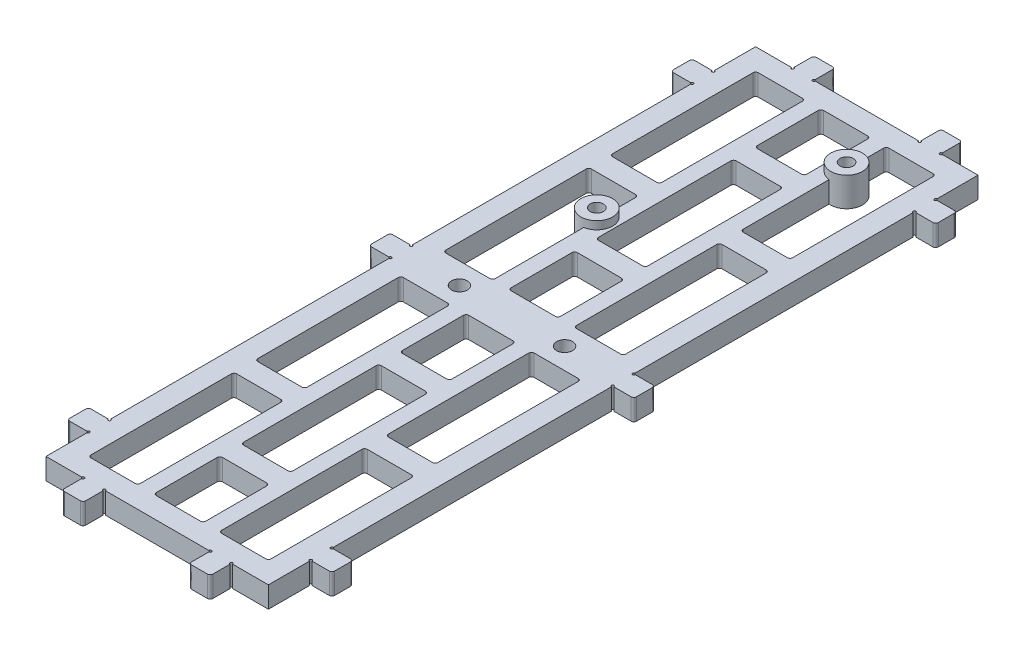
from build123d import *

# Parameters (mm, degrees)
SKETCH_1_W               = 42
SKETCH_1_H               = 134
SKETCH_1_R               = 1.5
EXTRUDE_1_DEPTH          = 2
CUT_EXTRUDE_4_DEPTH      = 4
EXTRUDE_3_DEPTH          = 1.5
EXTRUDE_3_DEPTH_BACK     = 4
SKETCH_2_R               = 3
CUT_EXTRUDE_5_DEPTH      = 71.32780389
CUT_EXTRUDE_5_DEPTH_BACK = 71.32780389
SKETCH_3_R               = 1.25
EXTRUDE_4_DEPTH          = 4
CUT_EXTRUDE_6_DEPTH      = 76.37904218
CUT_EXTRUDE_6_DEPTH_BACK = 76.37904218
SKETCH_6_R               = 0.25


with BuildPart() as part:
    # 草图1 → 凸台-拉伸1 (new, symmetric)
    with BuildSketch(Plane(origin=(0, 0, 0), x_dir=(1, 0, 0), z_dir=(0, 1, 0))):
        Rectangle(SKETCH_1_W, SKETCH_1_H)
        with Locations(Location((9.925, 0, 0), (0, 0, 270))):
            Circle(SKETCH_1_R, mode=Mode.SUBTRACT)
        with Locations(Location((-9.925, 0, 0), (0, 0, 90))):
            Circle(SKETCH_1_R, mode=Mode.SUBTRACT)
    extrude(amount=EXTRUDE_1_DEPTH, both=True)

    # 草图4 → 切除-拉伸4 (cut)
    with BuildSketch(Plane(origin=(0, 2, 0), x_dir=(1, 0, 0), z_dir=(0, 1, 0))):
        with BuildLine():
            Line((-16.5, -4), (-8.17, -4))
            ThreePointArc((-8.17, -4), (-7.816446609, -4.146446609), (-7.67, -4.5))
            Line((-7.67, -4.5), (-7.67, -31))
            ThreePointArc((-7.67, -31), (-7.816446609, -31.353553391), (-8.17, -31.5))
            Line((-8.17, -31.5), (-16.5, -31.5))
            ThreePointArc((-16.5, -31.5), (-16.853553391, -31.353553391), (-17, -31))
            Line((-17, -31), (-17, -4.5))
            ThreePointArc((-17, -4.5), (-16.853553391, -4.146446609), (-16.5, -4))
        make_face()
        with BuildLine():
            Line((16.5, -4), (8.17, -4))
            ThreePointArc((8.17, -4), (7.816446609, -4.146446609), (7.67, -4.5))
            Line((7.67, -4.5), (7.67, -31))
            ThreePointArc((7.67, -31), (7.816446609, -31.353553391), (8.17, -31.5))
            Line((8.17, -31.5), (16.5, -31.5))
            ThreePointArc((16.5, -31.5), (16.853553391, -31.353553391), (17, -31))
            Line((17, -31), (17, -4.5))
            ThreePointArc((17, -4.5), (16.853553391, -4.146446609), (16.5, -4))
        make_face()
        with BuildLine():
            Line((-16.5, -63), (-8.17, -63))
            ThreePointArc((-8.17, -63), (-7.816446609, -62.853553391), (-7.67, -62.5))
            Line((-7.67, -62.5), (-7.67, -36))
            ThreePointArc((-7.67, -36), (-7.816446609, -35.646446609), (-8.17, -35.5))
            Line((-8.17, -35.5), (-16.5, -35.5))
            ThreePointArc((-16.5, -35.5), (-16.853553391, -35.646446609), (-17, -36))
            Line((-17, -36), (-17, -62.5))
            ThreePointArc((-17, -62.5), (-16.853553391, -62.853553391), (-16.5, -63))
        make_face()
        with BuildLine():
            Line((16.5, -63), (8.17, -63))
            ThreePointArc((8.17, -63), (7.816446609, -62.853553391), (7.67, -62.5))
            Line((7.67, -62.5), (7.67, -36))
            ThreePointArc((7.67, -36), (7.816446609, -35.646446609), (8.17, -35.5))
            Line((8.17, -35.5), (16.5, -35.5))
            ThreePointArc((16.5, -35.5), (16.853553391, -35.646446609), (17, -36))
            Line((17, -36), (17, -62.5))
            ThreePointArc((17, -62.5), (16.853553391, -62.853553391), (16.5, -63))
        make_face()
        with BuildLine():
            Line((-4.67, -62.5), (-4.67, -51))
            ThreePointArc((-4.67, -51), (-4.523553391, -50.646446609), (-4.17, -50.5))
            Line((-4.17, -50.5), (4.17, -50.5))
            ThreePointArc((4.17, -50.5), (4.523553391, -50.646446609), (4.67, -51))
            Line((4.67, -51), (4.67, -62.5))
            ThreePointArc((4.67, -62.5), (4.523553391, -62.853553391), (4.17, -63))
            Line((4.17, -63), (-4.17, -63))
            ThreePointArc((-4.17, -63), (-4.523553391, -62.853553391), (-4.67, -62.5))
        make_face()
        with BuildLine():
            Line((-4.17, -20.5), (4.17, -20.5))
            ThreePointArc((4.17, -20.5), (4.523553391, -20.646446609), (4.67, -21))
            Line((4.67, -21), (4.67, -46))
            ThreePointArc((4.67, -46), (4.523553391, -46.353553391), (4.17, -46.5))
            Line((4.17, -46.5), (-4.17, -46.5))
            ThreePointArc((-4.17, -46.5), (-4.523553391, -46.353553391), (-4.67, -46))
            Line((-4.67, -46), (-4.67, -21))
            ThreePointArc((-4.67, -21), (-4.523553391, -20.646446609), (-4.17, -20.5))
        make_face()
        with BuildLine():
            Line((-4.17, -4), (4.17, -4))
            ThreePointArc((4.17, -4), (4.523553391, -4.146446609), (4.67, -4.5))
            Line((4.67, -4.5), (4.67, -16))
            ThreePointArc((4.67, -16), (4.523553391, -16.353553391), (4.17, -16.5))
            Line((4.17, -16.5), (-4.17, -16.5))
            ThreePointArc((-4.17, -16.5), (-4.523553391, -16.353553391), (-4.67, -16))
            Line((-4.67, -16), (-4.67, -4.5))
            ThreePointArc((-4.67, -4.5), (-4.523553391, -4.146446609), (-4.17, -4))
        make_face()
        with BuildLine():
            Line((-4.17, 63), (4.17, 63))
            ThreePointArc((4.17, 63), (4.523553391, 62.853553391), (4.67, 62.5))
            Line((4.67, 62.5), (4.67, 51))
            ThreePointArc((4.67, 51), (4.523553391, 50.646446609), (4.17, 50.5))
            Line((4.17, 50.5), (-4.17, 50.5))
            ThreePointArc((-4.17, 50.5), (-4.523553391, 50.646446609), (-4.67, 51))
            Line((-4.67, 51), (-4.67, 62.5))
            ThreePointArc((-4.67, 62.5), (-4.523553391, 62.853553391), (-4.17, 63))
        make_face()
        with BuildLine():
            Line((-17, 62.5), (-17, 36))
            ThreePointArc((-17, 36), (-16.853553391, 35.646446609), (-16.5, 35.5))
            Line((-16.5, 35.5), (-8.17, 35.5))
            ThreePointArc((-8.17, 35.5), (-7.816446609, 35.646446609), (-7.67, 36))
            Line((-7.67, 36), (-7.67, 62.5))
            ThreePointArc((-7.67, 62.5), (-7.816446609, 62.853553391), (-8.17, 63))
            Line((-8.17, 63), (-16.5, 63))
            ThreePointArc((-16.5, 63), (-16.853553391, 62.853553391), (-17, 62.5))
        make_face()
        with BuildLine():
            Line((-16.5, 31.5), (-8.17, 31.5))
            ThreePointArc((-8.17, 31.5), (-7.816446609, 31.353553391), (-7.67, 31))
            Line((-7.67, 31), (-7.67, 4.5))
            ThreePointArc((-7.67, 4.5), (-7.816446609, 4.146446609), (-8.17, 4))
            Line((-8.17, 4), (-16.5, 4))
            ThreePointArc((-16.5, 4), (-16.853553391, 4.146446609), (-17, 4.5))
            Line((-17, 4.5), (-17, 31))
            ThreePointArc((-17, 31), (-16.853553391, 31.353553391), (-16.5, 31.5))
        make_face()
        with BuildLine():
            Line((-4.17, 16.5), (4.17, 16.5))
            ThreePointArc((4.17, 16.5), (4.523553391, 16.353553391), (4.67, 16))
            Line((4.67, 16), (4.67, 4.5))
            ThreePointArc((4.67, 4.5), (4.523553391, 4.146446609), (4.17, 4))
            Line((4.17, 4), (-4.17, 4))
            ThreePointArc((-4.17, 4), (-4.523553391, 4.146446609), (-4.67, 4.5))
            Line((-4.67, 4.5), (-4.67, 16))
            ThreePointArc((-4.67, 16), (-4.523553391, 16.353553391), (-4.17, 16.5))
        make_face()
        with BuildLine():
            Line((-4.17, 46.5), (4.17, 46.5))
            ThreePointArc((4.17, 46.5), (4.523553391, 46.353553391), (4.67, 46))
            Line((4.67, 46), (4.67, 21))
            ThreePointArc((4.67, 21), (4.523553391, 20.646446609), (4.17, 20.5))
            Line((4.17, 20.5), (-4.17, 20.5))
            ThreePointArc((-4.17, 20.5), (-4.523553391, 20.646446609), (-4.67, 21))
            Line((-4.67, 21), (-4.67, 46))
            ThreePointArc((-4.67, 46), (-4.523553391, 46.353553391), (-4.17, 46.5))
        make_face()
        with BuildLine():
            Line((17, 4.5), (17, 31))
            ThreePointArc((17, 31), (16.853553391, 31.353553391), (16.5, 31.5))
            Line((16.5, 31.5), (8.17, 31.5))
            ThreePointArc((8.17, 31.5), (7.816446609, 31.353553391), (7.67, 31))
            Line((7.67, 31), (7.67, 4.5))
            ThreePointArc((7.67, 4.5), (7.816446609, 4.146446609), (8.17, 4))
            Line((8.17, 4), (16.5, 4))
            ThreePointArc((16.5, 4), (16.853553391, 4.146446609), (17, 4.5))
        make_face()
        with BuildLine():
            Line((17, 62.5), (17, 36))
            ThreePointArc((17, 36), (16.853553391, 35.646446609), (16.5, 35.5))
            Line((16.5, 35.5), (8.17, 35.5))
            ThreePointArc((8.17, 35.5), (7.816446609, 35.646446609), (7.67, 36))
            Line((7.67, 36), (7.67, 62.5))
            ThreePointArc((7.67, 62.5), (7.816446609, 62.853553391), (8.17, 63))
            Line((8.17, 63), (16.5, 63))
            ThreePointArc((16.5, 63), (16.853553391, 62.853553391), (17, 62.5))
        make_face()
    extrude(amount=-CUT_EXTRUDE_4_DEPTH, mode=Mode.SUBTRACT)

    # 草图2 → 凸台-拉伸3 (add, two sides: drawn at the far end of the back side and taken through both)
    with BuildSketch(Plane(origin=(0, 2, 0), x_dir=(1, 0, 0), z_dir=(0, 1, 0)).offset(-EXTRUDE_3_DEPTH_BACK)):
        with Locations(Location((7.98, 55.2, 0), (0, 0, 270))):
            Circle(SKETCH_2_R)
        with Locations(Location((-8.161477498, 24.171940191, 0), (0, 0, 270))):
            Circle(SKETCH_2_R)
    extrude(amount=EXTRUDE_3_DEPTH + EXTRUDE_3_DEPTH_BACK)

    # 草图3 → 切除-拉伸5 (cut, two sides: drawn at the far end of the back side and taken through both)
    with BuildSketch(Plane(origin=(0, 2, 0), x_dir=(1, 0, 0), z_dir=(0, 1, 0)).offset(-CUT_EXTRUDE_5_DEPTH_BACK)):
        with Locations(Location((-8.161477498, 24.171940191, 0), (0, 0, 270))):
            Circle(SKETCH_3_R)
        with Locations(Location((7.98, 55.2, 0), (0, 0, 270))):
            Circle(SKETCH_3_R)
    extrude(amount=CUT_EXTRUDE_5_DEPTH + CUT_EXTRUDE_5_DEPTH_BACK, mode=Mode.SUBTRACT)

    # 草图5 → 凸台-拉伸4 (add, through all)
    with BuildSketch(Plane(origin=(0, 2, 0), x_dir=(1, 0, 0), z_dir=(0, 1, 0))):
        with BuildLine():
            Line((21, 2), (24.5, 2))
            ThreePointArc((24.5, 2), (24.853553391, 1.853553391), (25, 1.5))
            Line((25, 1.5), (25, -1.5))
            ThreePointArc((25, -1.5), (24.853553391, -1.853553391), (24.5, -2))
            Line((24.5, -2), (21, -2))
            Line((21, -2), (21, 2))
        make_face()
        with BuildLine():
            Line((21, -55), (24.5, -55))
            ThreePointArc((24.5, -55), (24.853553391, -55.146446609), (25, -55.5))
            Line((25, -55.5), (25, -58.5))
            ThreePointArc((25, -58.5), (24.853553391, -58.853553391), (24.5, -59))
            Line((24.5, -59), (21, -59))
            Line((21, -59), (21, -55))
        make_face()
        with BuildLine():
            Line((21, 59), (24.5, 59))
            ThreePointArc((24.5, 59), (24.853553391, 58.853553391), (25, 58.5))
            Line((25, 58.5), (25, 55.5))
            ThreePointArc((25, 55.5), (24.853553391, 55.146446609), (24.5, 55))
            Line((24.5, 55), (21, 55))
            Line((21, 55), (21, 59))
        make_face()
        with BuildLine():
            Line((-21, 55), (-24.5, 55))
            ThreePointArc((-24.5, 55), (-24.853553391, 55.146446609), (-25, 55.5))
            Line((-25, 55.5), (-25, 58.5))
            ThreePointArc((-25, 58.5), (-24.853553391, 58.853553391), (-24.5, 59))
            Line((-24.5, 59), (-21, 59))
            Line((-21, 59), (-21, 55))
        make_face()
        with BuildLine():
            Line((-21, -2), (-24.5, -2))
            ThreePointArc((-24.5, -2), (-24.853553391, -1.853553391), (-25, -1.5))
            Line((-25, -1.5), (-25, 1.5))
            ThreePointArc((-25, 1.5), (-24.853553391, 1.853553391), (-24.5, 2))
            Line((-24.5, 2), (-21, 2))
            Line((-21, 2), (-21, -2))
        make_face()
        with BuildLine():
            Line((-21, -59), (-21, -55))
            Line((-21, -55), (-24.5, -55))
            ThreePointArc((-24.5, -55), (-24.853553391, -55.146446609), (-25, -55.5))
            Line((-25, -55.5), (-25, -58.5))
            ThreePointArc((-25, -58.5), (-24.853553391, -58.853553391), (-24.5, -59))
            Line((-24.5, -59), (-21, -59))
        make_face()
        with BuildLine():
            Line((-13.5, 71), (-10.5, 71))
            ThreePointArc((-10.5, 71), (-10.146446609, 70.853553391), (-10, 70.5))
            Line((-10, 70.5), (-10, 67))
            Line((-10, 67), (-14, 67))
            Line((-14, 67), (-14, 70.5))
            ThreePointArc((-14, 70.5), (-13.853553391, 70.853553391), (-13.5, 71))
        make_face()
        with BuildLine():
            Line((14, 67), (10, 67))
            Line((10, 67), (10, 70.5))
            ThreePointArc((10, 70.5), (10.146446609, 70.853553391), (10.5, 71))
            Line((10.5, 71), (13.5, 71))
            ThreePointArc((13.5, 71), (13.853553391, 70.853553391), (14, 70.5))
            Line((14, 70.5), (14, 67))
        make_face()
        with BuildLine():
            Line((-14, -67), (-10, -67))
            Line((-10, -67), (-10, -70.5))
            ThreePointArc((-10, -70.5), (-10.146446609, -70.853553391), (-10.5, -71))
            Line((-10.5, -71), (-13.5, -71))
            ThreePointArc((-13.5, -71), (-13.853553391, -70.853553391), (-14, -70.5))
            Line((-14, -70.5), (-14, -67))
        make_face()
        with BuildLine():
            Line((13.5, -71), (10.5, -71))
            ThreePointArc((10.5, -71), (10.146446609, -70.853553391), (10, -70.5))
            Line((10, -70.5), (10, -67))
            Line((10, -67), (14, -67))
            Line((14, -67), (14, -70.5))
            ThreePointArc((14, -70.5), (13.853553391, -70.853553391), (13.5, -71))
        make_face()
    extrude(amount=-EXTRUDE_4_DEPTH)

    # 草图6 → 切除-拉伸6 (cut, two sides: drawn at the far end of the back side and taken through both)
    with BuildSketch(Plane(origin=(0, 2, 0), x_dir=(1, 0, 0), z_dir=(0, 1, 0)).offset(-CUT_EXTRUDE_6_DEPTH_BACK)):
        with Locations((21, 59)):
            Circle(SKETCH_6_R)
        with Locations((21, 55)):
            Circle(SKETCH_6_R)
        with Locations((21, 2)):
            Circle(SKETCH_6_R)
        with Locations((21, -2)):
            Circle(SKETCH_6_R)
        with Locations((21, -55)):
            Circle(SKETCH_6_R)
        with Locations((21, -59)):
            Circle(SKETCH_6_R)
        with Locations((14, 67)):
            Circle(SKETCH_6_R)
        with Locations((10, 67)):
            Circle(SKETCH_6_R)
        with Locations((10, -67)):
            Circle(SKETCH_6_R)
        with Locations((14, -67)):
            Circle(SKETCH_6_R)
        with Locations((-14, -67)):
            Circle(SKETCH_6_R)
        with Locations((-10, -67)):
            Circle(SKETCH_6_R)
        with Locations((-10, 67)):
            Circle(SKETCH_6_R)
        with Locations((-14, 67)):
            Circle(SKETCH_6_R)
        with Locations((-21, -59)):
            Circle(SKETCH_6_R)
        with Locations((-21, -55)):
            Circle(SKETCH_6_R)
        with Locations((-21, -2)):
            Circle(SKETCH_6_R)
        with Locations((-21, 2)):
            Circle(SKETCH_6_R)
        with Locations((-21, 55)):
            Circle(SKETCH_6_R)
        with Locations((-21, 59)):
            Circle(SKETCH_6_R)
    extrude(amount=CUT_EXTRUDE_6_DEPTH + CUT_EXTRUDE_6_DEPTH_BACK, mode=Mode.SUBTRACT)


solid = part.part
